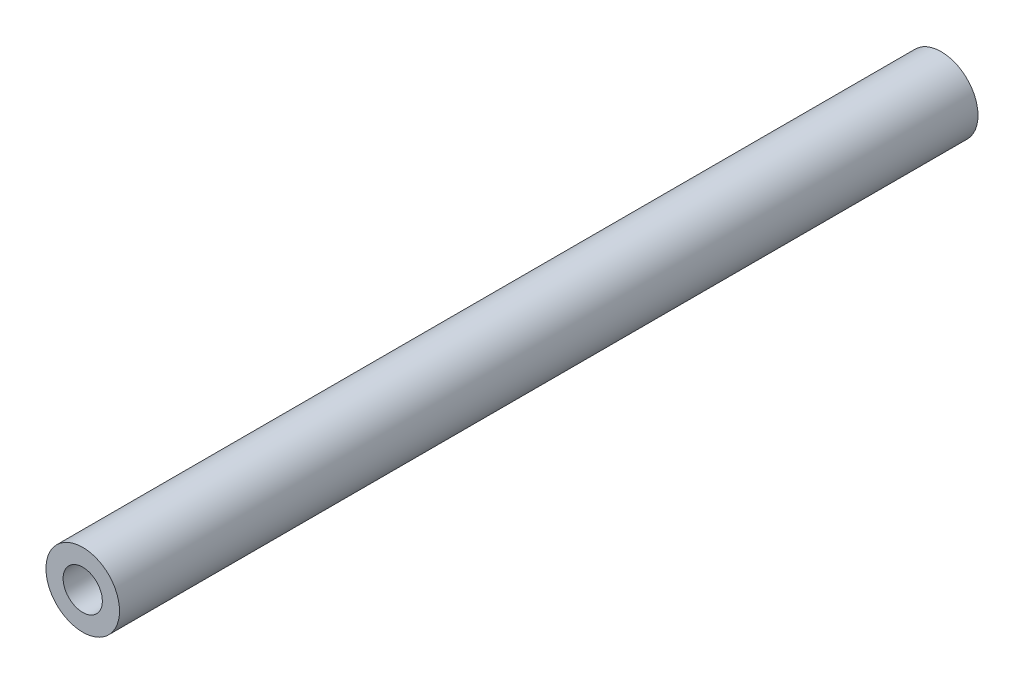
from build123d import *

# Parameters (mm, degrees)
SKETCH_1_R   = 3
SKETCH_1_R_2 = 1.6
F_70MM_DEPTH = 70


with BuildPart() as part:
    # 草图1 → 70mm铝柱 (new body)
    with BuildSketch(Plane.XY):
        Circle(SKETCH_1_R)
        Circle(SKETCH_1_R_2, mode=Mode.SUBTRACT)
    extrude(amount=F_70MM_DEPTH)


solid = part.part
